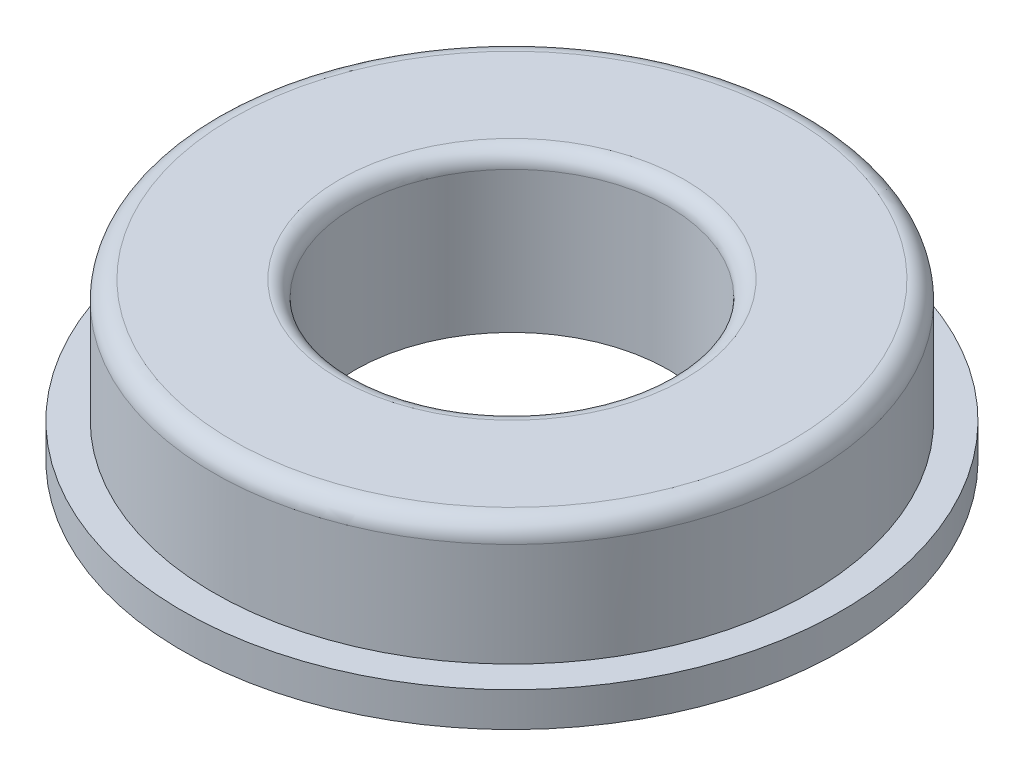
from build123d import *

# Parameters (mm, degrees)
FILLET_1_R = 0.6
FILLET_2_R = 0.5


with BuildPart() as part:
    # 草图2 → 旋转1 (revolve)
    with BuildSketch(Plane.XY, mode=Mode.PRIVATE) as revolve_1_sk:
        Polygon((0, 0), (4.5, 0), (4.5, -3.9), (5.5, -3.9), (5.5, -5), (0, -5), align=None)
    revolve(revolve_1_sk.sketch.rotate(Axis((-5, 0, 0), (0, -1, 0)), 180), axis=Axis((-5, 0, 0), (0, -1, 0)))

    # 圆角1
    fillet_1_edges = [part.edges().sort_by_distance(p)[0] for p in [
        (4.5, 0, 0),
    ]]
    fillet(fillet_1_edges, radius=FILLET_1_R)

    # 圆角2
    fillet_2_edges = [part.edges().sort_by_distance(p)[0] for p in [
        (0, 0, 0),
    ]]
    fillet(fillet_2_edges, radius=FILLET_2_R)


solid = part.part
